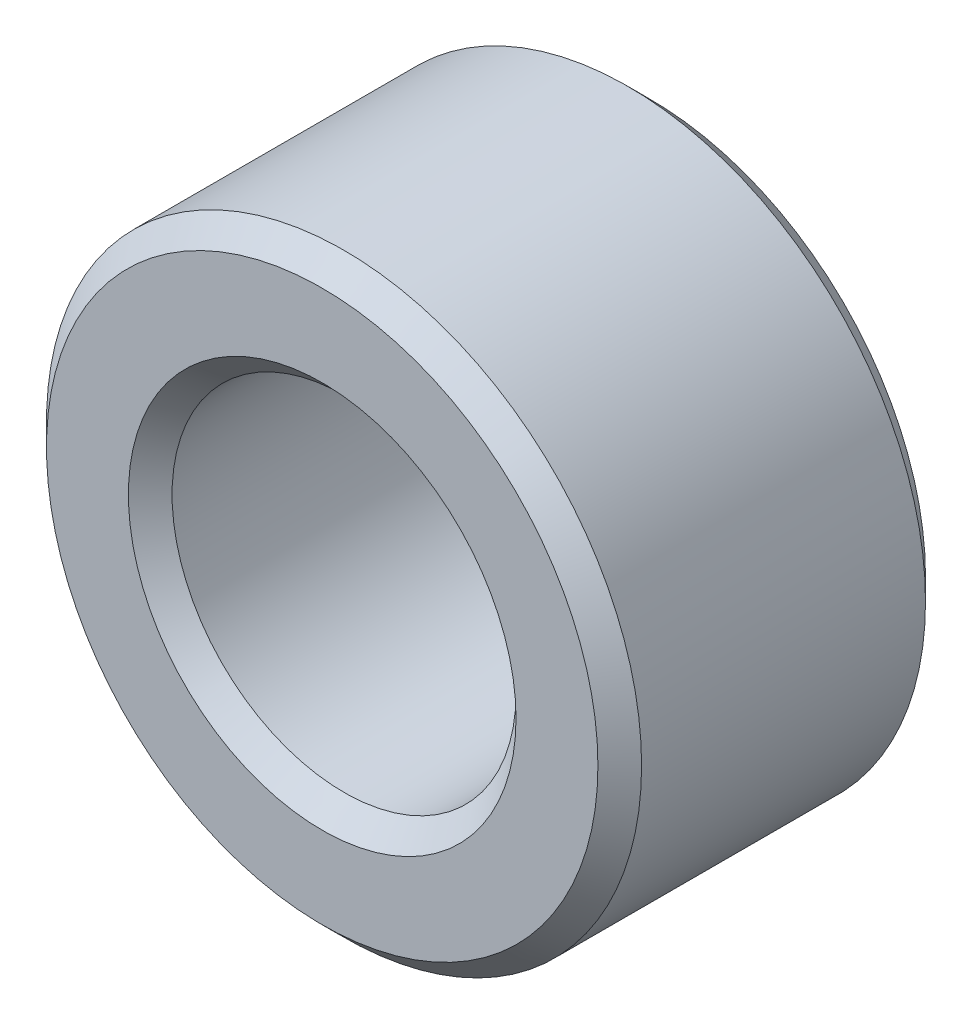
from build123d import *

# Parameters (mm, degrees)
SKETCH1_R           = 2.725
SKETCH1_R_2         = 1.575
BOSS_EXTRUDE1_DEPTH = 3
DEBURS_SIZE         = 0.2


with BuildPart() as part:
    # Sketch1 → Boss-Extrude1 (new body)
    with BuildSketch(Plane.XY):
        Circle(SKETCH1_R)
        Circle(SKETCH1_R_2, mode=Mode.SUBTRACT)
    extrude(amount=BOSS_EXTRUDE1_DEPTH)

    # Deburs
    deburs_edges = [part.edges().sort_by_distance(p)[0] for p in [
        (-2.725, 0, 0),
        (-2.725, 0, 3),
        (-1.575, 0, 0),
        (-1.575, 0, 3),
    ]]
    chamfer(deburs_edges, length=DEBURS_SIZE)


solid = part.part
